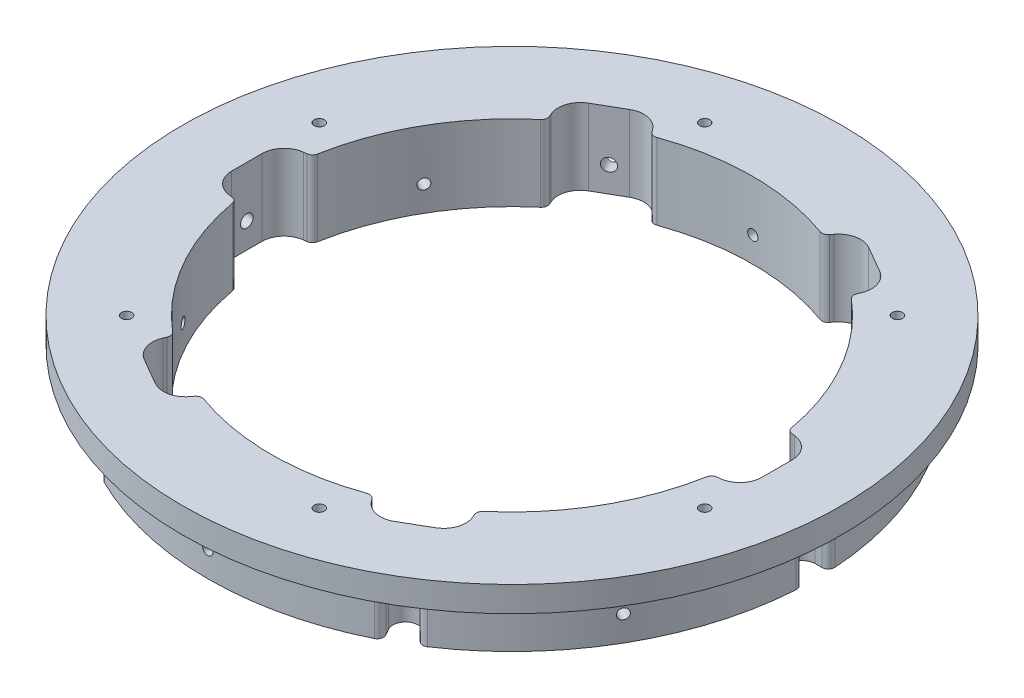
from build123d import *

# Parameters (mm, degrees)
SKETCH1_R                        = 76.2
SKETCH1_R_2                      = 60.325
BOSS_EXTRUDE1_DEPTH              = 19.05
CUT_EXTRUDE1_START               = -12.7
CUT_EXTRUDE1_DEPTH               = 12.7
CUT_EXTRUDE2_DEPTH               = 110.433918417
F_1_8_0_125_DIAMETER_HOLE1_D     = 3.175
F_1_8_0_125_DIAMETER_HOLE1_DEPTH = 9.779
FILLET1_R                        = 1.5875
FILLET2_R                        = 5.55625
SKETCH9_R                        = 1.28905
CUT_EXTRUDE3_DEPTH               = 110.433918434
SKETCH11_R                       = 1.28905
CUT_EXTRUDE5_DEPTH               = 110.433918573
CIRPATTERN1_COUNT                = 6
FILLET1_OF_CIRPATTERN1_R         = 1.5875
FILLET2_OF_CIRPATTERN1_R         = 5.55625
SKETCH8_R                        = 82.55
SKETCH8_R_2                      = 76.2
BOSS_EXTRUDE3_DEPTH              = 6.35


with BuildPart() as part:
    # Sketch1 → Boss-Extrude1 (new body)
    with BuildSketch(Plane(origin=(0, 0, 0), x_dir=(1, 0, 0), z_dir=(0, 1, 0))):
        with Locations(Location((0, 0, 0), (0, 0, 270))):
            Circle(SKETCH1_R)
        with Locations(Location((0, 0, 0), (0, 0, 270))):
            Circle(SKETCH1_R_2, mode=Mode.SUBTRACT)
    extrude(amount=-BOSS_EXTRUDE1_DEPTH)

    # Sketch3 → Cut-Extrude1 (cut)
    with BuildSketch(Plane(origin=(0, -19.05, 0), x_dir=(-1, 0, 0), z_dir=(0, -1, 0)).offset(CUT_EXTRUDE1_START)):
        with BuildLine():
            Line((-76.133825433, 3.175), (-72.771, 3.175))
            ThreePointArc((-72.771, 3.175), (-69.596, 0), (-72.771, -3.175))
            Line((-72.771, -3.175), (-76.133825433, -3.175))
            ThreePointArc((-76.133825433, -3.175), (-76.2, 0), (-76.133825433, 3.175))
        make_face()
    cut_extrude1 = extrude(amount=CUT_EXTRUDE1_DEPTH, mode=Mode.SUBTRACT)

    # Sketch4 → Cut-Extrude2 (cut, through all)
    with BuildSketch(Plane(origin=(0, -19.05, 0), x_dir=(-1, 0, 0), z_dir=(0, -1, 0))):
        Polygon((-66.421, 8.73125), (-66.421, -8.73125), (-59.56828015, -9.525), (-59.56828015, 9.525), align=None)
    cut_extrude2 = extrude(amount=-CUT_EXTRUDE2_DEPTH, mode=Mode.SUBTRACT)

    # 1/8 (0.125) Diameter Hole1
    with Locations(Plane.ZY.offset(-66.421)):
        with Locations((0, -12.7)):
            f_1_8_0_125_diameter_hole1 = Hole(F_1_8_0_125_DIAMETER_HOLE1_D / 2, depth=F_1_8_0_125_DIAMETER_HOLE1_DEPTH)

    # Fillet1
    fillet1_edges = [part.edges().sort_by_distance(p)[0] for p in [
        (76.133825433, -12.7, 3.175),
        (76.133825433, -12.7, -3.175),
        (59.56828015, -9.525, -9.525),
        (59.56828015, -9.525, 9.525),
    ]]
    fillet(fillet1_edges, radius=FILLET1_R)

    # Fillet2
    fillet2_edges = [part.edges().sort_by_distance(p)[0] for p in [
        (66.421, -9.525, -8.73125),
        (66.421, -9.525, 8.73125),
    ]]
    fillet(fillet2_edges, radius=FILLET2_R)

    # Sketch9 → Cut-Extrude3 (cut, through all)
    with BuildSketch(Plane.XY):
        with Locations((0, -12.7)):
            Circle(SKETCH9_R)
    cut_extrude3 = extrude(amount=-CUT_EXTRUDE3_DEPTH, mode=Mode.SUBTRACT)

    # Sketch11 → Cut-Extrude5 (cut, through all)
    with BuildSketch(Plane.XZ.offset(19.05)):
        with Locations(Location((65.936511717, 17.667635066, 0), (0, 0, 270))):
            Circle(SKETCH11_R)
    cut_extrude5 = extrude(amount=-CUT_EXTRUDE5_DEPTH, mode=Mode.SUBTRACT)

    # CirPattern1: Cut-Extrude1, Cut-Extrude2, 1/8 (0.125) Diameter Hole1, Cut-Extrude3, Cut-Extrude5 ×6 about axis
    cirpattern1_axis = Axis((0, 0, 0), (0, 1, 0))
    add([cut_extrude1.rotate(cirpattern1_axis, i * 360 / CIRPATTERN1_COUNT) for i in range(1, CIRPATTERN1_COUNT)], mode=Mode.SUBTRACT)
    add([cut_extrude2.rotate(cirpattern1_axis, i * 360 / CIRPATTERN1_COUNT) for i in range(1, CIRPATTERN1_COUNT)], mode=Mode.SUBTRACT)
    add([f_1_8_0_125_diameter_hole1.rotate(cirpattern1_axis, i * 360 / CIRPATTERN1_COUNT) for i in range(1, CIRPATTERN1_COUNT)], mode=Mode.SUBTRACT)
    add([cut_extrude3.rotate(cirpattern1_axis, i * 360 / CIRPATTERN1_COUNT) for i in range(1, CIRPATTERN1_COUNT)], mode=Mode.SUBTRACT)
    add([cut_extrude5.rotate(cirpattern1_axis, i * 360 / CIRPATTERN1_COUNT) for i in range(1, CIRPATTERN1_COUNT)], mode=Mode.SUBTRACT)

    # Fillet1 of CirPattern1
    fillet1_of_cirpattern1_edges = [part.edges().sort_by_distance(p)[0] for p in [
        (40.816543373, -12.7, -64.346326912),
        (35.317282059, -12.7, -67.521326912),
        (21.535248104, -9.525, -56.350143869),
        (38.033032046, -9.525, -46.825143869),
        (-35.317282059, -12.7, -67.521326912),
        (-40.816543373, -12.7, -64.346326912),
        (-38.033032046, -9.525, -46.825143869),
        (-21.535248104, -9.525, -56.350143869),
        (-76.133825433, -12.7, -3.175),
        (-76.133825433, -12.7, 3.175),
        (-59.56828015, -9.525, 9.525),
        (-59.56828015, -9.525, -9.525),
        (-40.816543373, -12.7, 64.346326912),
        (-35.317282059, -12.7, 67.521326912),
        (-21.535248104, -9.525, 56.350143869),
        (-38.033032046, -9.525, 46.825143869),
        (35.317282059, -12.7, 67.521326912),
        (40.816543373, -12.7, 64.346326912),
        (38.033032046, -9.525, 46.825143869),
        (21.535248104, -9.525, 56.350143869),
    ]]
    fillet(fillet1_of_cirpattern1_edges, radius=FILLET1_OF_CIRPATTERN1_R)

    # Fillet2 of CirPattern1
    fillet2_of_cirpattern1_edges = [part.edges().sort_by_distance(p)[0] for p in [
        (25.649015693, -9.525, -61.887898345),
        (40.771984307, -9.525, -53.156648345),
        (-40.771984307, -9.525, -53.156648345),
        (-25.649015693, -9.525, -61.887898345),
        (-66.421, -9.525, 8.73125),
        (-66.421, -9.525, -8.73125),
        (-25.649015693, -9.525, 61.887898345),
        (-40.771984307, -9.525, 53.156648345),
        (40.771984307, -9.525, 53.156648345),
        (25.649015693, -9.525, 61.887898345),
    ]]
    fillet(fillet2_of_cirpattern1_edges, radius=FILLET2_OF_CIRPATTERN1_R)

    # Sketch8 → Boss-Extrude3 (add)
    with BuildSketch(Plane(origin=(0, 0, 0), x_dir=(1, 0, 0), z_dir=(0, 1, 0))):
        with Locations(Location((0, 0, 0), (0, 0, 270))):
            Circle(SKETCH8_R)
        Circle(SKETCH8_R_2, mode=Mode.SUBTRACT)
    extrude(amount=-BOSS_EXTRUDE3_DEPTH)


solid = part.part
